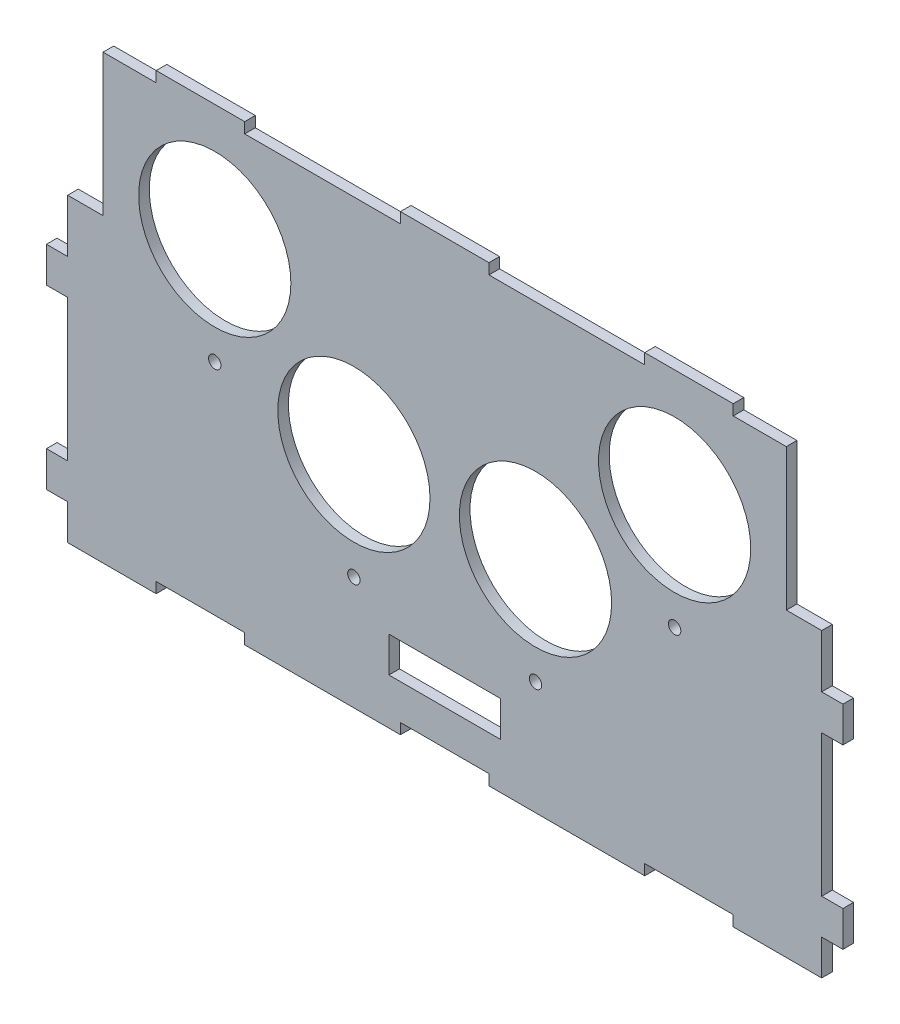
from build123d import *

# Parameters (mm, degrees)
SKETCH_1_R      = 43
SKETCH_1_R_2    = 3.5
SKETCH_1_W      = 63
SKETCH_1_H      = 20
EXTRUDE_2_DEPTH = 6


with BuildPart() as part:
    # Эскиз1 → Бобышка-Вытянуть2 (new body)
    with BuildSketch(Plane.XY):
        Polygon((450, 20), (450, 40), (438, 40), (438, 120), (450, 120), (450, 140), (438, 140), (438, 170), (418, 170), (418, 250), (388, 250), (388, 256), (338, 256), (338, 250), (250, 250), (250, 256), (200, 256), (200, 250), (112, 250), (112, 256), (62, 256), (62, 250), (32, 250), (32, 170), (12, 170), (12, 140), (0, 140), (0, 120), (12, 120), (12, 40), (0, 40), (0, 20), (12, 20), (12, 0), (62, 0), (62, 6), (112, 6), (112, 0), (200, 0), (200, 6), (250, 6), (250, 0), (338, 0), (338, 6), (388, 6), (388, 0), (438, 0), (438, 20), align=None)
        with Locations((95.096189432, 190)):
            Circle(SKETCH_1_R, mode=Mode.SUBTRACT)
        with Locations((173.696978501, 124.046106882)):
            Circle(SKETCH_1_R, mode=Mode.SUBTRACT)
        with Locations((276.303021499, 124.046106882)):
            Circle(SKETCH_1_R, mode=Mode.SUBTRACT)
        with Locations((354.903810568, 190)):
            Circle(SKETCH_1_R, mode=Mode.SUBTRACT)
        with Locations((95.096189432, 130)):
            Circle(SKETCH_1_R_2, mode=Mode.SUBTRACT)
        with Locations((173.696978501, 64.046106882)):
            Circle(SKETCH_1_R_2, mode=Mode.SUBTRACT)
        with Locations((276.303021499, 64.046106882)):
            Circle(SKETCH_1_R_2, mode=Mode.SUBTRACT)
        with Locations((354.903810568, 130)):
            Circle(SKETCH_1_R_2, mode=Mode.SUBTRACT)
        with Locations((225, 36)):
            Rectangle(SKETCH_1_W, SKETCH_1_H, mode=Mode.SUBTRACT)
    extrude(amount=EXTRUDE_2_DEPTH)


solid = part.part
